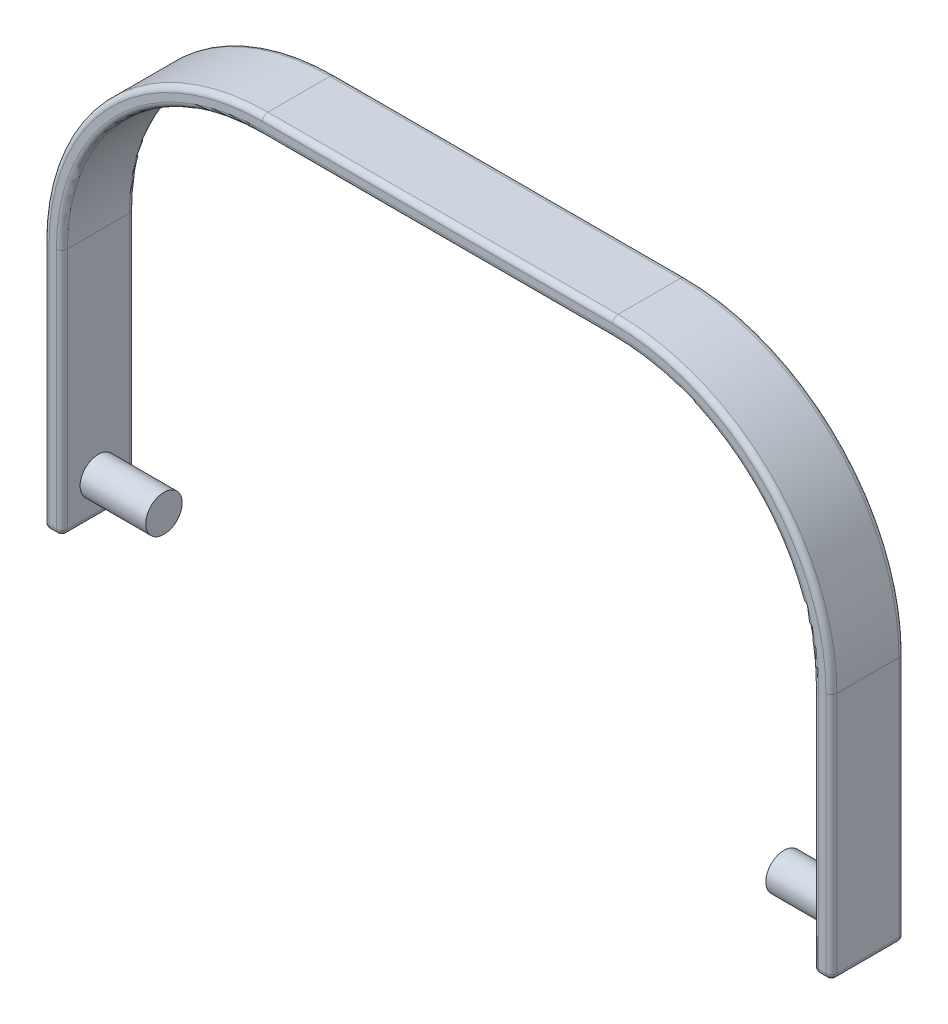
from build123d import *

# Parameters (mm, degrees)
SKETCH_2_W               = 216
SKETCH_2_H               = 128
EXTRUDE_1_DEPTH          = 20
FILLET_1_R               = 60
CUT_EXTRUDE_1_DEPTH      = 252.872983863
CUT_EXTRUDE_1_DEPTH_BACK = 20
SKETCH_4_R               = 5
EXTRUDE_2_DEPTH          = 18
EXTRUDE_START            = 18
SKETCH_5_R               = 5
EXTRUDE_3_DEPTH          = 18
FILLET_2_R               = 1.5


with BuildPart() as part:
    # ｽｹｯﾁ2 → ﾎﾞｽ - 押し出し1 (new body)
    with BuildSketch(Plane.XY):
        with Locations((108, 64)):
            Rectangle(SKETCH_2_W, SKETCH_2_H)
    extrude(amount=EXTRUDE_1_DEPTH)

    # ﾌｨﾚｯﾄ1
    fillet_1_edges = [part.edges().sort_by_distance(p)[0] for p in [
        (0, 128, 10),
        (216, 128, 10),
    ]]
    fillet(fillet_1_edges, radius=FILLET_1_R)

    # ｽｹｯﾁ3 → ｶｯﾄ - 押し出し1 (cut, two sides: drawn at the far end of the back side and taken through both)
    with BuildSketch(Plane.XY.offset(20).offset(-CUT_EXTRUDE_1_DEPTH_BACK)):
        with BuildLine():
            Line((211, -503.578767777), (211, 0))
            Line((211, 0), (211, 68))
            ThreePointArc((211, 68), (194.890872965, 106.890872965), (156, 123))
            Line((156, 123), (60, 123))
            ThreePointArc((60, 123), (21.109127035, 106.890872965), (5, 68))
            Line((5, 68), (5, 0))
            Line((5, 0), (5, -503.578767777))
            Line((5, -503.578767777), (5, -1510.73630333))
            Line((5, -1510.73630333), (211, -1510.73630333))
            Line((211, -1510.73630333), (211, -503.578767777))
        make_face()
    extrude(amount=CUT_EXTRUDE_1_DEPTH + CUT_EXTRUDE_1_DEPTH_BACK, mode=Mode.SUBTRACT)

    # ｽｹｯﾁ4 → ﾎﾞｽ - 押し出し2 (add)
    with BuildSketch(Plane(origin=(5, 0, 0), x_dir=(0, 0, -1), z_dir=(1, 0, 0))):
        with Locations(Location((-10, 10, 0), (0, 0, 270))):
            Circle(SKETCH_4_R)
    extrude(amount=EXTRUDE_2_DEPTH)

    # ｽｹｯﾁ5 → ﾎﾞｽ - 押し出し3 (add)
    with BuildSketch(Plane.ZY.offset(-211).offset(EXTRUDE_START)):
        with Locations(Location((10, 10, 0), (0, 0, 270))):
            Circle(SKETCH_5_R)
    extrude(amount=-EXTRUDE_3_DEPTH)

    # ﾌｨﾚｯﾄ2
    fillet_2_edges = [part.edges().sort_by_distance(p)[0] for p in [
        (216, 34, 20),
        (108, 128, 0),
        (108, 128, 20),
        (0, 34, 0),
        (17.573593129, 110.426406871, 0),
        (198.426406871, 110.426406871, 0),
        (0, 34, 20),
        (17.573593129, 110.426406871, 20),
        (198.426406871, 110.426406871, 20),
        (213.5, 0, 0),
        (213.5, 0, 20),
        (211, 0, 10),
        (211, 34, 20),
        (194.890872965, 106.890872965, 20),
        (108, 123, 20),
        (21.109127035, 106.890872965, 20),
        (5, 34, 20),
        (5, 0, 10),
        (5, 34, 0),
        (211, 34, 0),
        (194.890872965, 106.890872965, 0),
        (108, 123, 0),
        (21.109127035, 106.890872965, 0),
        (216, 34, 0),
        (2.5, 0, 0),
        (216, 0, 10),
        (0, 0, 10),
        (2.5, 0, 20),
    ]]
    fillet(fillet_2_edges, radius=FILLET_2_R)


solid = part.part
